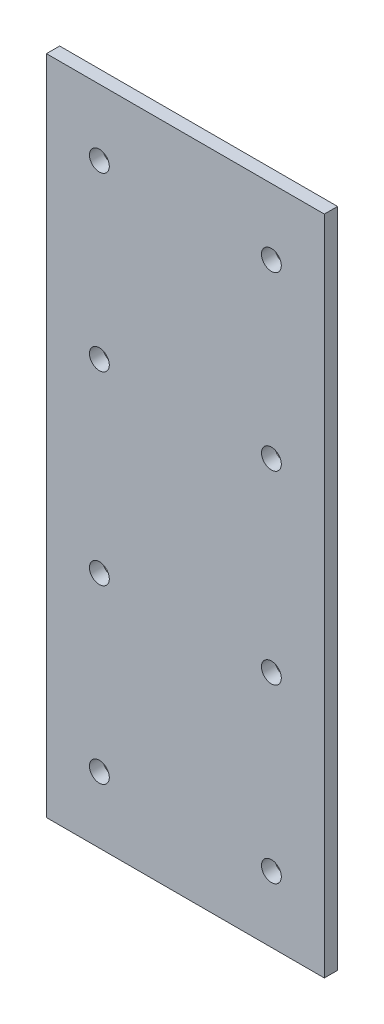
from build123d import *

# Parameters (mm, degrees)
SKETCH1_W           = 42
SKETCH1_H           = 100
BOSS_EXTRUDE1_DEPTH = 2
SKETCH2_R           = 1.5
CUT_EXTRUDE1_DEPTH  = 2


with BuildPart() as part:
    # Sketch1 → Boss-Extrude1 (new body)
    with BuildSketch(Plane.XY):
        Rectangle(SKETCH1_W, SKETCH1_H)
    extrude(amount=BOSS_EXTRUDE1_DEPTH)

    # Sketch2 → Cut-Extrude1 (cut)
    with BuildSketch(Plane.XY.offset(2)):
        with Locations((-13, -40)):
            Circle(SKETCH2_R)
        with Locations((13, -40)):
            Circle(SKETCH2_R)
        with Locations(Location((13, -14, 0), (0, 0, 180))):
            Circle(SKETCH2_R)
        with Locations(Location((-13, -14, 0), (0, 0, 180))):
            Circle(SKETCH2_R)
        with Locations(Location((13, 40, 0), (0, 0, 180))):
            Circle(SKETCH2_R)
        with Locations(Location((-13, 40, 0), (0, 0, 180))):
            Circle(SKETCH2_R)
        with Locations((13, 14)):
            Circle(SKETCH2_R)
        with Locations((-13, 14)):
            Circle(SKETCH2_R)
    extrude(amount=-CUT_EXTRUDE1_DEPTH, mode=Mode.SUBTRACT)


solid = part.part
